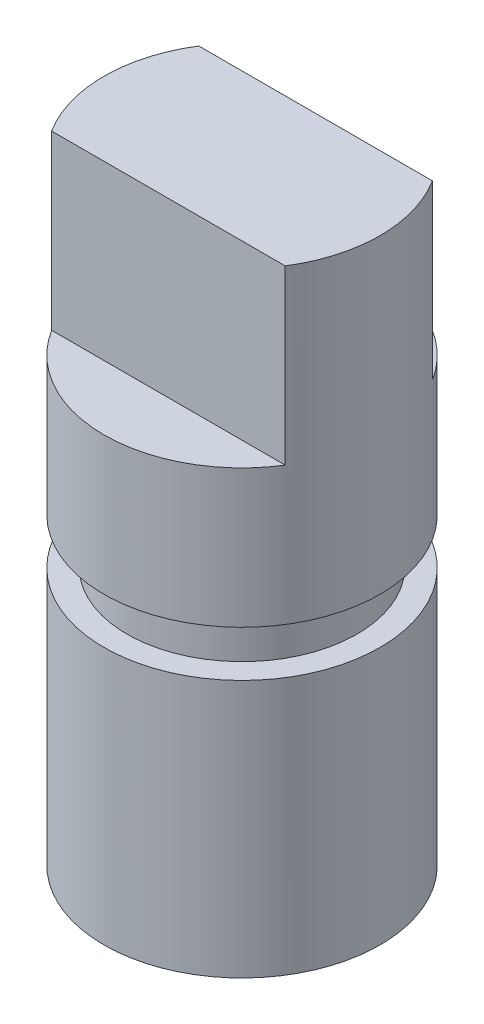
from build123d import *

# Parameters (mm, degrees)
SKETCH1_R           = 3
BOSS_EXTRUDE1_DEPTH = 9.6
SKETCH2_R           = 1.75
CUT_EXTRUDE1_DEPTH  = 1
BOSS_EXTRUDE2_DEPTH = 3.75
SKETCH4_W           = 0.5
SKETCH4_H           = 1


with BuildPart() as part:
    # Sketch1 → Boss-Extrude1 (new body)
    with BuildSketch(Plane(origin=(0, 0, 0), x_dir=(1, 0, 0), z_dir=(0, 1, 0))):
        with Locations(Location((0, 0, 0), (0, 0, 270))):
            Circle(SKETCH1_R)
    extrude(amount=BOSS_EXTRUDE1_DEPTH)

    # Sketch2 → Cut-Extrude1 (cut)
    with BuildSketch(Plane.XZ):
        with Locations(Location((0, 0, 0), (0, 0, 270))):
            Circle(SKETCH2_R)
    extrude(amount=-CUT_EXTRUDE1_DEPTH, mode=Mode.SUBTRACT)

    # Sketch3 → Boss-Extrude2 (add)
    with BuildSketch(Plane(origin=(0, 9.6, 0), x_dir=(1, 0, 0), z_dir=(0, 1, 0))):
        with BuildLine():
            Line((-2.537715508, -1.6), (2.537715508, -1.6))
            ThreePointArc((2.537715508, -1.6), (3, 0), (2.537715508, 1.6))
            Line((2.537715508, 1.6), (-2.537715508, 1.6))
            ThreePointArc((-2.537715508, 1.6), (-3, 0), (-2.537715508, -1.6))
        make_face()
    extrude(amount=BOSS_EXTRUDE2_DEPTH)

    # Sketch4 → Cut-Revolve2 (revolve, cut)
    with BuildSketch(Plane(origin=(0, 0, 0), x_dir=(0, 0, -1), z_dir=(1, 0, 0)), mode=Mode.PRIVATE) as cut_revolve2_sk:
        with Locations((-2.75, 6.1)):
            Rectangle(SKETCH4_W, SKETCH4_H)
    revolve(cut_revolve2_sk.sketch.rotate(Axis((0, 0, 0), (0, 1, 0)), 180), axis=Axis((0, 0, 0), (0, 1, 0)), mode=Mode.SUBTRACT)


solid = part.part
